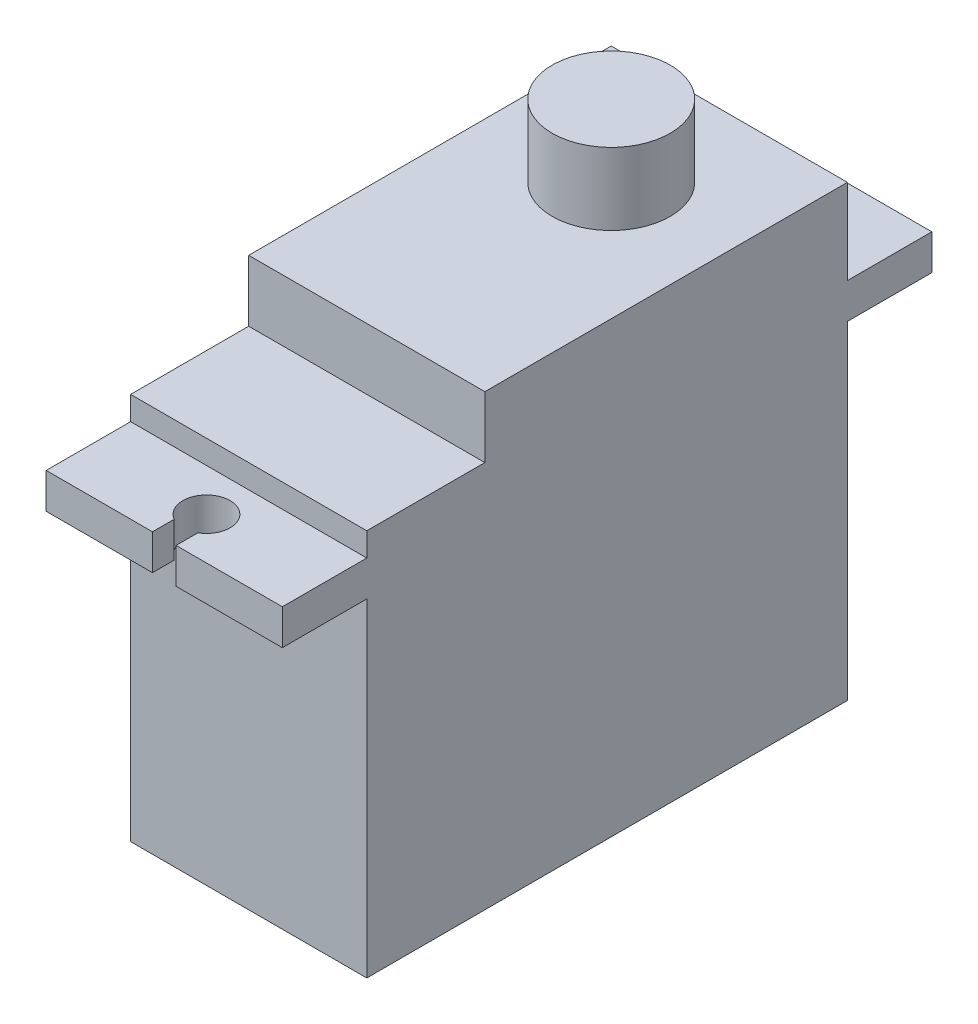
from build123d import *

# Parameters (mm, degrees)
SKETCH2_W           = 40.7
SKETCH2_H           = 32.8
SKETCH2_W_2         = 7.15
SKETCH2_H_2         = 3
BOSS_EXTRUDE1_DEPTH = 10
SKETCH3_R           = 5
BOSS_EXTRUDE2_DEPTH = 6.1
CUT_EXTRUDE1_DEPTH  = 43.483996987


with BuildPart() as part:
    # Sketch2 → Boss-Extrude1 (new, symmetric)
    with BuildSketch(Plane(origin=(0, 0, 0), x_dir=(0, 0, -1), z_dir=(1, 0, 0))):
        Rectangle(SKETCH2_W, SKETCH2_H)
        with Locations((-23.925, 12.9)):
            Rectangle(SKETCH2_W_2, SKETCH2_H_2)
        with Locations((23.925, 12.9)):
            Rectangle(SKETCH2_W_2, SKETCH2_H_2)
        Polygon((-10.35, 16.4), (20.35, 16.4), (20.35, 21.6), (15.35, 21.6), (5.35, 21.6), (-10.35, 21.6), align=None)
    extrude(amount=BOSS_EXTRUDE1_DEPTH, both=True)

    # Sketch3 → Boss-Extrude2 (add)
    with BuildSketch(Plane(origin=(0, 21.6, 0), x_dir=(1, 0, 0), z_dir=(0, 1, 0))):
        with Locations(Location((0, 10.35, 0), (0, 0, 270))):
            Circle(SKETCH3_R)
    extrude(amount=BOSS_EXTRUDE2_DEPTH)

    # Sketch4 → Cut-Extrude1 (cut, through all)
    with BuildSketch(Plane(origin=(0, 14.4, 0), x_dir=(1, 0, 0), z_dir=(0, 1, 0))):
        with BuildLine():
            Line((-1, -25.657050808), (-1, -27.5))
            Line((-1, -27.5), (1, -27.5))
            Line((1, -27.5), (1, -25.657050808))
            ThreePointArc((1, -25.657050808), (0, -25.925), (-1, -25.657050808))
        make_face()
        with BuildLine():
            ThreePointArc((2, -23.925), (-1, -22.192949192), (-1, -25.657050808))
            Line((-1, -25.657050808), (1, -25.657050808))
            ThreePointArc((1, -25.657050808), (1.732050808, -24.925), (2, -23.925))
        make_face()
        with BuildLine():
            Line((1, -25.657050808), (-1, -25.657050808))
            ThreePointArc((-1, -25.657050808), (0, -25.925), (1, -25.657050808))
        make_face()
        with BuildLine():
            ThreePointArc((2, 23.925), (1.732050808, 24.925), (1, 25.657050808))
            Line((1, 25.657050808), (-1, 25.657050808))
            ThreePointArc((-1, 25.657050808), (-1, 22.192949192), (2, 23.925))
        make_face()
        with BuildLine():
            Line((-1, 25.657050808), (1, 25.657050808))
            ThreePointArc((1, 25.657050808), (0, 25.925), (-1, 25.657050808))
        make_face()
        with BuildLine():
            Line((1, 25.657050808), (1, 27.5))
            Line((1, 27.5), (-1, 27.5))
            Line((-1, 27.5), (-1, 25.657050808))
            ThreePointArc((-1, 25.657050808), (0, 25.925), (1, 25.657050808))
        make_face()
    extrude(amount=-CUT_EXTRUDE1_DEPTH, mode=Mode.SUBTRACT)


solid = part.part
